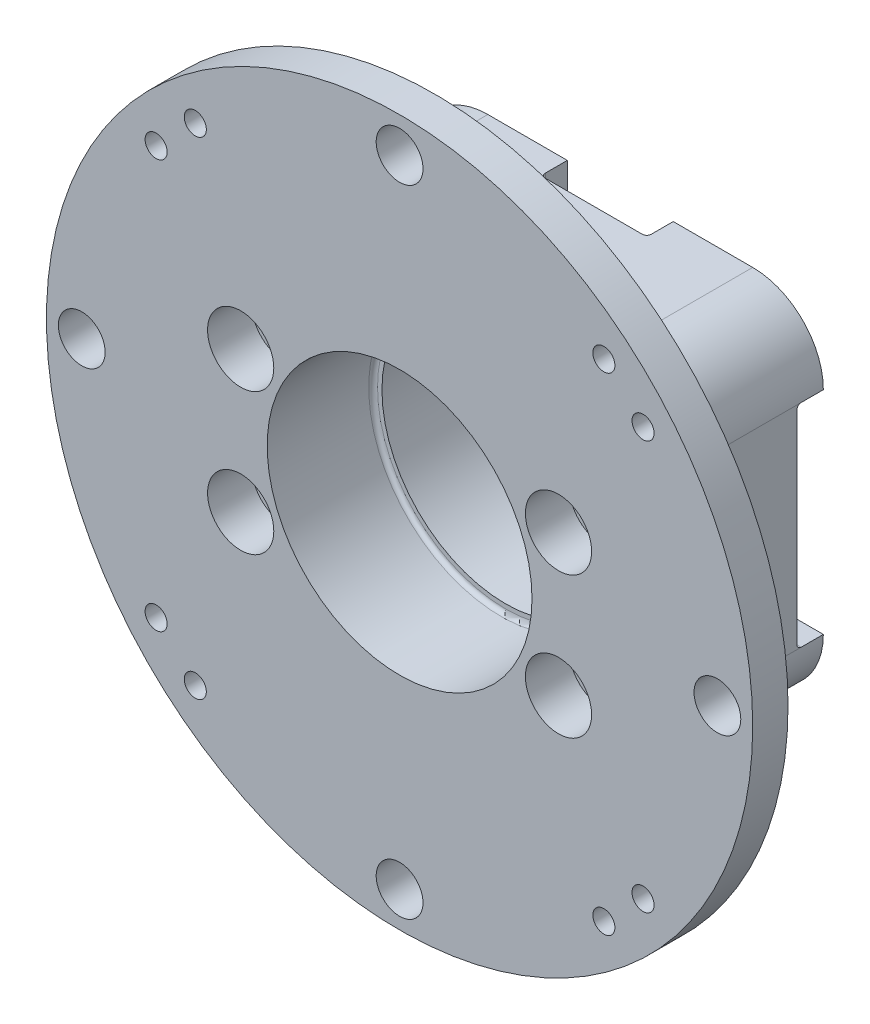
from build123d import *

# Parameters (mm, degrees)
SKETCH1_W                       = 46
SKETCH1_H                       = 40
BOSS_EXTRUDE1_DEPTH             = 21
CUT_EXTRUDE1_DEPTH              = 3
FILLET1_R                       = 8
SKETCH20_R                      = 40
BOSS_EXTRUDE3_DEPTH             = 4
M5_CLEARANCE_HOLE2_D            = 5.3
CIRPATTERN3_COUNT               = 4
SKETCH24_R                      = 14
CUT_EXTRUDE2_DEPTH              = 61.695963622
SKETCH25_R                      = 15
CUT_EXTRUDE3_DEPTH              = 12
M3X0_5_TAPPED_HOLE1_D           = 2.5
CIRPATTERN4_COUNT               = 4
CBORE_FOR_M4_SBHCS1_D           = 4.3
CBORE_FOR_M4_SBHCS1_CBORE_D     = 7.5
CBORE_FOR_M4_SBHCS1_CBORE_DEPTH = 5
FILLET2_R                       = 1
FILLET3_R                       = 0.5
FILLET4_R                       = 0.5


with BuildPart() as part:
    # Sketch1 → Boss-Extrude1 (new body)
    with BuildSketch(Plane.XY):
        Rectangle(SKETCH1_W, SKETCH1_H)
    extrude(amount=BOSS_EXTRUDE1_DEPTH)

    # Sketch2 → Cut-Extrude1 (cut)
    with BuildSketch(Plane(origin=(0, 0, 0), x_dir=(-1, 0, 0), z_dir=(0, 0, -1))):
        with BuildLine():
            Line((-23, -12), (-12.737739203, -12))
            ThreePointArc((-12.737739203, -12), (-9.62821501, -14.613263692), (-6, -16.439282223))
            Line((-6, -16.439282223), (-6, -20))
            Line((-6, -20), (6, -20))
            Line((6, -20), (6, -16.439282223))
            ThreePointArc((6, -16.439282223), (9.62821501, -14.613263692), (12.737739203, -12))
            Line((12.737739203, -12), (23, -12))
            Line((23, -12), (23, 12))
            Line((23, 12), (12.737739203, 12))
            ThreePointArc((12.737739203, 12), (9.62821501, 14.613263692), (6, 16.439282223))
            Line((6, 16.439282223), (6, 20))
            Line((6, 20), (-6, 20))
            Line((-6, 20), (-6, 16.439282223))
            ThreePointArc((-6, 16.439282223), (-9.62821501, 14.613263692), (-12.737739203, 12))
            Line((-12.737739203, 12), (-23, 12))
            Line((-23, 12), (-23, -12))
        make_face()
    extrude(amount=-CUT_EXTRUDE1_DEPTH, mode=Mode.SUBTRACT)

    # Fillet1
    fillet1_edges = [part.edges().sort_by_distance(p)[0] for p in [
        (-23, -20, 10.5),
        (23, -20, 10.5),
        (-23, 20, 10.5),
        (23, 20, 10.5),
    ]]
    fillet(fillet1_edges, radius=FILLET1_R)

    # Sketch20 → Boss-Extrude3 (add)
    with BuildSketch(Plane.XY.offset(21)):
        Circle(SKETCH20_R)
    extrude(amount=BOSS_EXTRUDE3_DEPTH)

    # M5 Clearance Hole2 (through all)
    with Locations(Plane.XY.offset(25)):
        with Locations((-36, 0)):
            m5_clearance_hole2 = Hole(M5_CLEARANCE_HOLE2_D / 2)

    # CirPattern3: M5 Clearance Hole2 ×4 about axis
    cirpattern3_axis = Axis((0, 0, 0), (0, 0, 1))
    for i in range(1, CIRPATTERN3_COUNT):
        add(m5_clearance_hole2.rotate(cirpattern3_axis, i * 360 / CIRPATTERN3_COUNT), mode=Mode.SUBTRACT)

    # Sketch24 → Cut-Extrude2 (cut, through all)
    with BuildSketch(Plane(origin=(0, 0, 3), x_dir=(-1, 0, 0), z_dir=(0, 0, -1))):
        Circle(SKETCH24_R)
    extrude(amount=-CUT_EXTRUDE2_DEPTH, mode=Mode.SUBTRACT)

    # Sketch25 → Cut-Extrude3 (cut)
    with BuildSketch(Plane.XY.offset(25)):
        Circle(SKETCH25_R)
    extrude(amount=-CUT_EXTRUDE3_DEPTH, mode=Mode.SUBTRACT)

    # M3x0.5 Tapped Hole1 (through all)
    with Locations(Plane(origin=(0, 0, 21), x_dir=(-1, 0, 0), z_dir=(0, 0, -1))):
        with Locations((23.140353949, 27.577599952), (27.577599952, 23.140353949)):
            m3x0_5_tapped_hole1 = Hole(M3X0_5_TAPPED_HOLE1_D / 2)

    # CirPattern4: M3x0.5 Tapped Hole1 ×4 about axis
    cirpattern4_axis = Axis((0, 0, 0), (0, 0, 1))
    for i in range(1, CIRPATTERN4_COUNT):
        add(m3x0_5_tapped_hole1.rotate(cirpattern4_axis, i * 360 / CIRPATTERN4_COUNT), mode=Mode.SUBTRACT)

    # CBORE for M4 SBHCS1 (through all)
    with Locations(Plane.XY.offset(25)):
        with Locations((-18, -8), (-18, 8), (18, -8), (18, 8)):
            CounterBoreHole(CBORE_FOR_M4_SBHCS1_D / 2, CBORE_FOR_M4_SBHCS1_CBORE_D / 2, CBORE_FOR_M4_SBHCS1_CBORE_DEPTH)

    # Fillet2
    fillet2_edges = [part.edges().sort_by_distance(p)[0] for p in [
        (0, -20, 21),
        (-23, 0, 21),
        (23, 0, 21),
        (0, 20, 21),
        (20.656854249, 17.656854249, 21),
        (-20.656854249, 17.656854249, 21),
        (20.656854249, -17.656854249, 21),
        (-20.656854249, -17.656854249, 21),
    ]]
    fillet(fillet2_edges, radius=FILLET2_R)

    # Fillet3
    fillet3_edges = [part.edges().sort_by_distance(p)[0] for p in [
        (6, 18.219641111, 3),
        (-9.62821501, 14.613263692, 3),
        (-17.868869601, 12, 3),
        (-9.62821501, -14.613263692, 3),
        (-6, -18.219641111, 3),
        (9.62821501, -14.613263692, 3),
        (17.868869601, -12, 3),
        (17.868869601, 12, 3),
        (9.62821501, 14.613263692, 3),
        (-6, 18.219641111, 3),
        (-17.868869601, -12, 3),
        (6, -18.219641111, 3),
    ]]
    fillet(fillet3_edges, radius=FILLET3_R)

    # Fillet4
    fillet4_edges = [part.edges().sort_by_distance(p)[0] for p in [
        (-15, 0, 13),
    ]]
    fillet(fillet4_edges, radius=FILLET4_R)


solid = part.part
